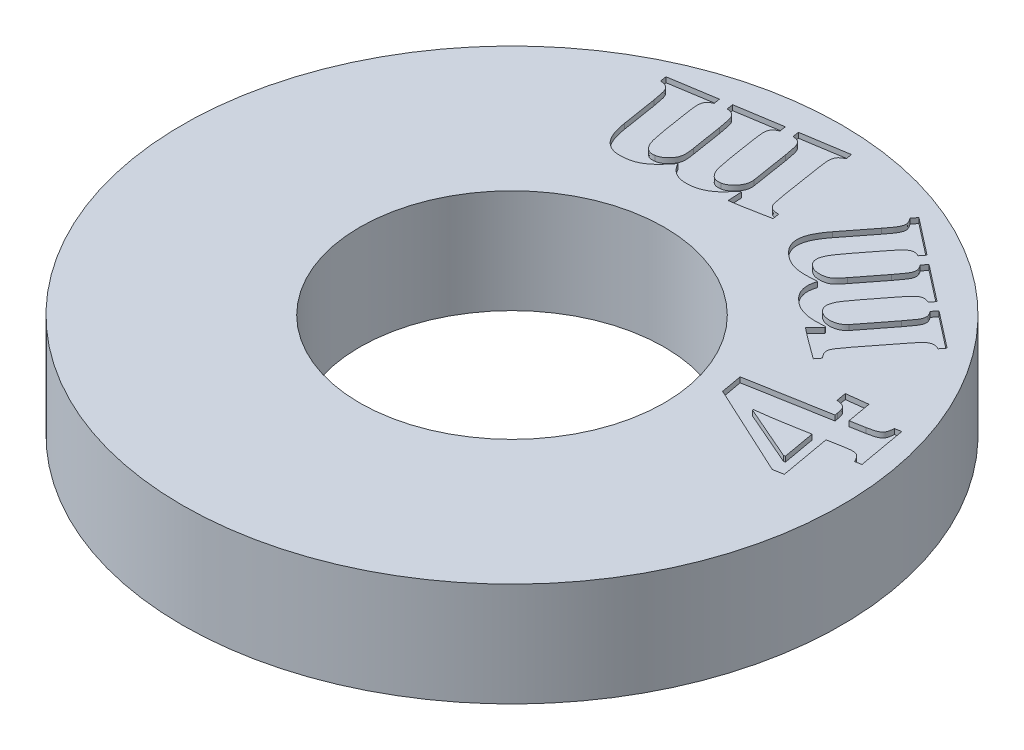
from build123d import *

# Parameters (mm, degrees)
SKETCH1_R           = 12.7
BOSS_EXTRUDE1_DEPTH = 4
SKETCH2_R           = 5.8674
CUT_EXTRUDE1_DEPTH  = 19.40054347
CUT_EXTRUDE2_DEPTH  = 0.2


with BuildPart() as part:
    # Sketch1 → Boss-Extrude1 (new body)
    with BuildSketch(Plane(origin=(0, 0, 0), x_dir=(1, 0, 0), z_dir=(0, 1, 0))):
        with Locations(Location((0, 0, 0), (0, 0, 270))):
            Circle(SKETCH1_R)
    extrude(amount=BOSS_EXTRUDE1_DEPTH)

    # Sketch2 → Cut-Extrude1 (cut, through all)
    with BuildSketch(Plane(origin=(0, 0, 0), x_dir=(-1, 0, 0), z_dir=(0, -1, 0))):
        with Locations(Location((0, 0, 0), (0, 0, 90))):
            Circle(SKETCH2_R)
    extrude(amount=-CUT_EXTRUDE1_DEPTH, mode=Mode.SUBTRACT)

    # Sketch4 → Cut-Extrude2 (cut)
    # profile 1 of 3: a face of its own
    with BuildSketch(Plane(origin=(0, 4, 0), x_dir=(1, 0, 0), z_dir=(0, 1, 0))):
        with BuildLine():
            add(Edge.make_bspline(
                [(11.488408618, 1.713177083), (11.469838832, 1.751163486), (11.436392431, 1.81958153), (11.378099004, 1.90717716), (11.314847291, 1.972864293), (11.237317047, 2.013217491), (11.145336245, 2.031877301), (11.036310839, 2.027073218), (10.905471379, 2.011895355), (10.810712295, 1.995562245), (10.75859959, 1.986579861)],
                knots=[0, 0, 0, 0, 1.150028644, 2.071338816, 2.856635104, 3.60405379, 4.412524947, 5.383041063, 6.560804909, 8, 8, 8, 8], degree=3))
            Line((10.75859959, 1.986579861), (10.213998896, 1.889565972))
            Line((10.213998896, 1.889565972), (10.562366951, -0.068350694))
            Line((10.562366951, -0.068350694), (10.167696812, -0.13890625))
            Line((10.167696812, -0.13890625), (6.603538826, 1.513637153))
            Line((6.603538826, 1.513637153), (6.456915562, 2.334947917))
            Line((6.456915562, 2.334947917), (9.561360007, 2.888368056))
            Line((9.561360007, 2.888368056), (9.541516257, 3.001918403))
            add(Edge.make_bspline(
                [(9.541516257, 3.001918403), (9.53621884, 3.029525548), (9.526503379, 3.080157044), (9.510174137, 3.149094233), (9.493400102, 3.204430233), (9.468458459, 3.259415491), (9.428357686, 3.315475518), (9.371014626, 3.355777123), (9.313871477, 3.381367905), (9.256659474, 3.397341601), (9.187294175, 3.410242281), (9.136608942, 3.415702209), (9.109363479, 3.418637153)],
                knots=[0, 0, 0, 0, 1.247718715, 2.28831579, 3.144719151, 3.808968319, 4.963983276, 6.154957496, 6.870509644, 7.737720758, 8.783928937, 10, 10, 10, 10], degree=3))
            Line((9.109363479, 3.418637153), (9.041012785, 3.802282986))
            Line((9.041012785, 3.802282986), (9.855708965, 3.901501736))
            Line((9.855708965, 3.901501736), (10.021073548, 2.969947917))
            Line((10.021073548, 2.969947917), (10.565674243, 3.066961806))
            add(Edge.make_bspline(
                [(10.565674243, 3.066961806), (10.596191498, 3.072744873), (10.654042391, 3.083707707), (10.735546427, 3.100672221), (10.806327725, 3.119847372), (10.884650937, 3.143106434), (10.964993338, 3.177938075), (11.042473733, 3.230582572), (11.09682001, 3.296665245), (11.127250552, 3.377974375), (11.144207274, 3.473236339), (11.152211458, 3.542056701), (11.156577021, 3.579592014)],
                knots=[0, 0, 0, 0, 1.056895867, 2.003534391, 2.831506833, 3.551299363, 4.782749837, 5.795840817, 6.711673096, 7.642742077, 8.71432796, 10, 10, 10, 10], degree=3))
            Line((11.156577021, 3.579592014), (11.398009312, 3.622586806))
            Line((11.398009312, 3.622586806), (11.72984091, 1.756171875))
            Line((11.72984091, 1.756171875), (11.488408618, 1.713177083))
        make_face()
        with BuildLine():
            Line((9.976976326, 0.558932292), (9.754285354, 1.807986111))
            Line((9.754285354, 1.807986111), (8.917540562, 1.659157986))
            add(Edge.make_bspline(
                [(8.917540562, 1.659157986), (8.828662767, 1.643775664), (8.64857728, 1.612607778), (8.374325176, 1.57121124), (8.092496542, 1.532179982), (7.901875903, 1.509637341), (7.805188132, 1.498203125)],
                knots=[0, 0, 0, 0, 0.962862618, 1.950966311, 2.960676556, 4, 4, 4, 4], degree=3))
            Line((7.805188132, 1.498203125), (7.811802715, 1.461822917))
            Line((7.811802715, 1.461822917), (9.915240215, 0.547907986))
            Line((9.915240215, 0.547907986), (9.976976326, 0.558932292))
        make_face(mode=Mode.SUBTRACT)
    # profile 2 of 3: a face of its own
    with BuildSketch(Plane(origin=(0, 4, 0), x_dir=(1, 0, 0), z_dir=(0, 1, 0))):
        with BuildLine():
            Line((6.446112276, 5.621046804), (6.418551512, 5.656324582))
            add(Edge.make_bspline(
                [(6.418551512, 5.656324582), (6.345103003, 5.650481726), (6.205690041, 5.639391375), (6.006049673, 5.640001619), (5.827169527, 5.650699674), (5.666856777, 5.67597167), (5.521469939, 5.714933464), (5.387561193, 5.768451828), (5.261579098, 5.83414063), (5.185430088, 5.889090651), (5.147449081, 5.916498193)],
                knots=[0, 0, 0, 0, 1.328700104, 2.522011983, 3.598465663, 4.558669638, 5.444794913, 6.307777922, 7.155966722, 8, 8, 8, 8], degree=3))
            add(Edge.make_bspline(
                [(5.147449081, 5.916498193), (5.113549109, 5.943897718), (5.048106477, 5.996791479), (4.961452983, 6.081290035), (4.888569595, 6.165417061), (4.830459206, 6.250285271), (4.784446219, 6.336029232), (4.750511209, 6.423590405), (4.725338541, 6.51279674), (4.712276312, 6.605066622), (4.710185373, 6.700889708), (4.719470407, 6.800614492), (4.739279008, 6.904788894), (4.760550248, 6.974274273), (4.771520262, 7.010109304)],
                knots=[0, 0, 0, 0, 1.254723853, 2.422197594, 3.480533536, 4.455073735, 5.378270259, 6.276377898, 7.154433995, 8.041941717, 8.952311201, 9.908521309, 10.921381655, 12, 12, 12, 12], degree=3))
            add(Edge.make_bspline(
                [(4.771520262, 7.010109304), (4.691090698, 7.003656459), (4.538471998, 6.991411896), (4.321666343, 6.98846259), (4.129911724, 6.995416816), (3.960718577, 7.018564153), (3.808601542, 7.056299759), (3.667745769, 7.110172456), (3.535147857, 7.17881181), (3.454567942, 7.236924978), (3.414428248, 7.265873193)],
                knots=[0, 0, 0, 0, 1.366310217, 2.59263486, 3.670585393, 4.613332156, 5.479848919, 6.319088227, 7.162678639, 8, 8, 8, 8], degree=3))
            add(Edge.make_bspline(
                [(3.414428248, 7.265873193), (3.3775521, 7.295803428), (3.306764809, 7.353257376), (3.21306857, 7.444735382), (3.134735925, 7.535260481), (3.072420666, 7.626680072), (3.027114725, 7.721083516), (2.993029681, 7.816985205), (2.9748084, 7.916670154), (2.967827049, 8.01881721), (2.974809687, 8.124007378), (2.995095498, 8.231959079), (3.028806982, 8.342103336), (3.074329878, 8.45600405), (3.135236882, 8.572567121), (3.206795227, 8.695687314), (3.293019282, 8.822881794), (3.357079528, 8.907680315), (3.390174776, 8.951489512)],
                knots=[0, 0, 0, 0, 1.169264857, 2.244515684, 3.220319539, 4.113963992, 4.959955291, 5.792870505, 6.612950669, 7.447388896, 8.308923635, 9.201834464, 10.146760853, 11.141726431, 12.218423767, 13.382633535, 14.647798067, 16, 16, 16, 16], degree=3))
            Line((3.390174776, 8.951489512), (4.221407414, 10.019744721))
            add(Edge.make_bspline(
                [(4.221407414, 10.019744721), (4.253451667, 10.061583607), (4.315528507, 10.14263483), (4.402700621, 10.258852189), (4.474099835, 10.363054012), (4.52285553, 10.455601314), (4.552580969, 10.535251364), (4.563466398, 10.608503251), (4.558254548, 10.679867299), (4.53147758, 10.75154504), (4.489681708, 10.826689156), (4.454202161, 10.876320457), (4.435278942, 10.902791596)],
                knots=[0, 0, 0, 0, 1.558183804, 3.018548385, 4.296309646, 5.28770402, 6.105589718, 6.797073249, 7.462098622, 8.197436721, 9.038592567, 10, 10, 10, 10], degree=3))
            Line((4.435278942, 10.902791596), (4.585209498, 11.095716943))
            Line((4.585209498, 11.095716943), (5.996320609, 9.99769611))
            Line((5.996320609, 9.99769611), (5.846390053, 9.804770762))
            add(Edge.make_bspline(
                [(5.846390053, 9.804770762), (5.821598554, 9.814853431), (5.775331585, 9.833670142), (5.707363836, 9.85237221), (5.646143658, 9.858436215), (5.590929353, 9.853196728), (5.540343575, 9.836119226), (5.490007513, 9.81172786), (5.439948532, 9.776609976), (5.384915117, 9.732987716), (5.324969903, 9.670799848), (5.252764521, 9.589061458), (5.16514284, 9.485038198), (5.10380747, 9.40664927), (5.070278942, 9.36379854)],
                knots=[0, 0, 0, 0, 0.974495288, 1.818645247, 2.55789592, 3.203887047, 3.821953837, 4.492443581, 5.234959137, 6.043992897, 7.047297203, 8.374577793, 10.01818969, 12, 12, 12, 12], degree=3))
            Line((5.070278942, 9.36379854), (4.459532414, 8.578867985))
            add(Edge.make_bspline(
                [(4.459532414, 8.578867985), (4.427040039, 8.536727017), (4.36533113, 8.456693682), (4.279860313, 8.340926267), (4.207480509, 8.23488918), (4.144743666, 8.140152652), (4.093939387, 8.053261371), (4.055224804, 7.972382939), (4.025674683, 7.897486598), (4.007618905, 7.827463577), (3.999758774, 7.762907557), (3.999966382, 7.703395202), (4.005428339, 7.648104338), (4.021722039, 7.597238119), (4.045740851, 7.549179791), (4.078974228, 7.503189368), (4.121883321, 7.458704343), (4.154616135, 7.431294161), (4.171798039, 7.416906179)],
                knots=[0, 0, 0, 0, 1.888953508, 3.587465034, 5.107152686, 6.445866775, 7.620537267, 8.676590056, 9.626254862, 10.474157069, 11.23623705, 11.927603465, 12.58451522, 13.199276758, 13.811819934, 14.485105834, 15.204811187, 16, 16, 16, 16], degree=3))
            add(Edge.make_bspline(
                [(4.171798039, 7.416906179), (4.196907921, 7.398623115), (4.24575502, 7.363056452), (4.329546375, 7.32690278), (4.419900083, 7.306286873), (4.515987475, 7.298075567), (4.611843152, 7.301326536), (4.703352488, 7.308761322), (4.788476175, 7.328417137), (4.868537558, 7.362467429), (4.944132959, 7.410449543), (5.003782637, 7.463505766), (5.054181963, 7.517595359), (5.101176163, 7.571027473), (5.155289779, 7.638105142), (5.193805445, 7.686959904), (5.214697345, 7.713459999)],
                knots=[0, 0, 0, 0, 1.060451807, 2.062932707, 3.097103212, 4.220994073, 5.353228603, 6.376944908, 7.359261765, 8.328691766, 9.340596163, 10.410182602, 11.05076008, 11.870698325, 12.845011315, 14, 14, 14, 14], degree=3))
            Line((5.214697345, 7.713459999), (5.957735539, 8.66816486))
            add(Edge.make_bspline(
                [(5.957735539, 8.66816486), (5.982092993, 8.699319813), (6.027952625, 8.757977615), (6.090423825, 8.841053313), (6.142342187, 8.913544593), (6.197870379, 8.990195), (6.249297759, 9.073408186), (6.29114706, 9.165636672), (6.310604917, 9.252795431), (6.30324831, 9.324426645), (6.285186466, 9.381667531), (6.264023921, 9.429739499), (6.232698883, 9.48084353), (6.207857504, 9.515367573), (6.194758109, 9.533572846)],
                knots=[0, 0, 0, 0, 1.428852229, 2.69020885, 3.755221618, 4.650440021, 6.110052653, 7.281631402, 8.297160143, 9.297295893, 9.839073942, 10.463254767, 11.189641066, 12, 12, 12, 12], degree=3))
            Line((6.194758109, 9.533572846), (6.344688664, 9.726498193))
            Line((6.344688664, 9.726498193), (7.739263317, 8.640604096))
            Line((7.739263317, 8.640604096), (7.589332762, 8.447678749))
            add(Edge.make_bspline(
                [(7.589332762, 8.447678749), (7.564184317, 8.458169169), (7.516888214, 8.477898261), (7.447738497, 8.497032573), (7.385486432, 8.504959726), (7.329450384, 8.499379022), (7.278376194, 8.482329334), (7.227319552, 8.459564119), (7.178554253, 8.423744301), (7.124521011, 8.380289164), (7.065790511, 8.31767881), (6.99307334, 8.236382683), (6.90602346, 8.130825514), (6.84391499, 8.052041093), (6.809914359, 8.008911387)],
                knots=[0, 0, 0, 0, 0.986342731, 1.854992093, 2.591493093, 3.247165752, 3.874524497, 4.535580437, 5.263002682, 6.057269968, 7.045676649, 8.365642244, 10.010408946, 12, 12, 12, 12], degree=3))
            Line((6.809914359, 8.008911387), (6.199167831, 7.223980832))
            add(Edge.make_bspline(
                [(6.199167831, 7.223980832), (6.1751448, 7.193217202), (6.128820384, 7.133894666), (6.064470667, 7.047003547), (6.005667413, 6.967536238), (5.953399564, 6.894695326), (5.908577343, 6.827540339), (5.869029665, 6.766708727), (5.837481339, 6.710333021), (5.802625077, 6.644943933), (5.770963015, 6.567952334), (5.744339164, 6.480543218), (5.734321689, 6.398573054), (5.736407268, 6.323235217), (5.755317287, 6.253747629), (5.786992728, 6.186877603), (5.838949571, 6.122592111), (5.883831274, 6.085438123), (5.908126164, 6.065326318)],
                knots=[0, 0, 0, 0, 1.387103131, 2.674797394, 3.842386028, 4.900548409, 5.86041802, 6.711809731, 7.478006622, 8.155605191, 9.344042684, 10.43114453, 11.391724629, 12.267604767, 13.091197959, 13.932310922, 14.880740337, 16, 16, 16, 16], degree=3))
            add(Edge.make_bspline(
                [(5.908126164, 6.065326318), (5.92724958, 6.05188526), (5.966036324, 6.024623661), (6.032692056, 5.993550347), (6.107049239, 5.971043667), (6.187819264, 5.954527731), (6.272883487, 5.946510823), (6.359519721, 5.950174322), (6.446294721, 5.963823989), (6.53258789, 5.986026651), (6.614596751, 6.020389001), (6.690833791, 6.063035119), (6.757619821, 6.117520035), (6.794712531, 6.160658186), (6.813221651, 6.182183957)],
                knots=[0, 0, 0, 0, 0.841485411, 1.706728545, 2.636983739, 3.637338779, 4.674903333, 5.709078804, 6.7546484, 7.837656936, 8.912857559, 9.95143668, 10.977774795, 12, 12, 12, 12], degree=3))
            Line((6.813221651, 6.182183957), (7.695166095, 7.315482568))
            add(Edge.make_bspline(
                [(7.695166095, 7.315482568), (7.728014018, 7.358000395), (7.788496594, 7.436288075), (7.869304066, 7.544976045), (7.931241751, 7.634991871), (7.976730187, 7.708273557), (8.008966806, 7.771056115), (8.029709996, 7.829288183), (8.042924298, 7.885143031), (8.045069208, 7.940051692), (8.037490603, 7.996136863), (8.014924563, 8.054405487), (7.980117392, 8.116225886), (7.950303267, 8.156952636), (7.934393526, 8.178685693)],
                knots=[0, 0, 0, 0, 1.946253878, 3.583619155, 4.90541557, 5.903065839, 6.706730513, 7.456203084, 8.137693296, 8.777198399, 9.436082692, 10.17303834, 11.025076595, 12, 12, 12, 12], degree=3))
            Line((7.934393526, 8.178685693), (8.084324081, 8.37161104))
            Line((8.084324081, 8.37161104), (9.487718178, 7.27910236))
            Line((9.487718178, 7.27910236), (9.337787623, 7.086177012))
            add(Edge.make_bspline(
                [(9.337787623, 7.086177012), (9.310775429, 7.0966318), (9.260723911, 7.116003717), (9.187673864, 7.135537847), (9.123019149, 7.144452452), (9.064830325, 7.140087962), (9.012522306, 7.124265196), (8.960801373, 7.102391813), (8.910212078, 7.069482703), (8.856472687, 7.026121446), (8.796761068, 6.965984534), (8.724427609, 6.885322286), (8.638553239, 6.78089514), (8.576615815, 6.702998059), (8.542935192, 6.660638818)],
                knots=[0, 0, 0, 0, 1.0399122, 1.926877353, 2.71123319, 3.373420874, 4.004478301, 4.666665984, 5.384545304, 6.163885671, 7.144097132, 8.424650005, 10.055779381, 12, 12, 12, 12], degree=3))
            Line((8.542935192, 6.660638818), (7.60586922, 5.456784651))
            add(Edge.make_bspline(
                [(7.60586922, 5.456784651), (7.579695927, 5.423041412), (7.531000421, 5.360261992), (7.464615767, 5.272214489), (7.410772827, 5.196862452), (7.35505243, 5.118965683), (7.3062141, 5.034369264), (7.266301268, 4.941020505), (7.257033, 4.850826575), (7.268994039, 4.777697278), (7.294307526, 4.717385158), (7.326608903, 4.665864149), (7.367927347, 4.606464412), (7.401556879, 4.566478611), (7.419558456, 4.545074582)],
                knots=[0, 0, 0, 0, 1.450639645, 2.698920323, 3.745170182, 4.597024574, 5.950243738, 7.060652374, 8.014587129, 8.989365666, 9.543411076, 10.226324432, 11.050567859, 12, 12, 12, 12], degree=3))
            Line((7.419558456, 4.545074582), (7.264115748, 4.345534651))
            Line((7.264115748, 4.345534651), (6.442804984, 4.947461735))
            Line((6.442804984, 4.947461735), (6.074593178, 5.234093679))
            Line((6.074593178, 5.234093679), (6.446112276, 5.621046804))
        make_face()
    # profile 3 of 3: a face of its own
    with BuildSketch(Plane(origin=(0, 4, 0), x_dir=(1, 0, 0), z_dir=(0, 1, 0))):
        with BuildLine():
            Line((0.313853362, 8.525956305), (0.266448848, 8.530366027))
            add(Edge.make_bspline(
                [(0.266448848, 8.530366027), (0.220587801, 8.472712263), (0.133110419, 8.362740934), (-0.004365315, 8.216579062), (-0.134419634, 8.091399905), (-0.26345541, 7.991600635), (-0.391287899, 7.911021784), (-0.522521219, 7.849326117), (-0.657183893, 7.801559088), (-0.750062007, 7.783960964), (-0.796294208, 7.775201097)],
                knots=[0, 0, 0, 0, 1.321709555, 2.521087024, 3.598960819, 4.558109064, 5.44394598, 6.305457593, 7.156502851, 8, 8, 8, 8], degree=3))
            add(Edge.make_bspline(
                [(-0.796294208, 7.775201097), (-0.839944877, 7.768960851), (-0.923669459, 7.756991687), (-1.045452622, 7.751329453), (-1.157309896, 7.756606178), (-1.259753383, 7.771731323), (-1.354164127, 7.797300062), (-1.441453203, 7.833576517), (-1.52489044, 7.87569231), (-1.601582422, 7.92961482), (-1.673310621, 7.993632909), (-1.739982334, 8.068486542), (-1.802626549, 8.154631273), (-1.839037783, 8.217645133), (-1.857934833, 8.250348666)],
                knots=[0, 0, 0, 0, 1.262383675, 2.421327046, 3.485651979, 4.465097507, 5.381738202, 6.278834679, 7.168553644, 8.05321575, 8.955237983, 9.91670527, 10.918791849, 12, 12, 12, 12], degree=3))
            add(Edge.make_bspline(
                [(-1.857934833, 8.250348666), (-1.90877596, 8.187008607), (-2.00522163, 8.066852448), (-2.151117808, 7.90429903), (-2.290041501, 7.770169918), (-2.42237, 7.660920578), (-2.554191293, 7.574649228), (-2.690177048, 7.508178238), (-2.831656224, 7.457141582), (-2.929902909, 7.438416019), (-2.979106708, 7.429037902)],
                knots=[0, 0, 0, 0, 1.367019779, 2.593237953, 3.673809289, 4.614754209, 5.477752088, 6.31872209, 7.157984213, 8, 8, 8, 8], degree=3))
            add(Edge.make_bspline(
                [(-2.979106708, 7.429037902), (-3.026059084, 7.422313077), (-3.116363637, 7.40937907), (-3.247369376, 7.404275703), (-3.367795645, 7.408861262), (-3.477868354, 7.42618411), (-3.579049507, 7.456379764), (-3.672210418, 7.498761458), (-3.759200344, 7.552032666), (-3.839177412, 7.617470965), (-3.910830954, 7.695734725), (-3.976479508, 7.784665243), (-4.034537182, 7.885532337), (-4.086457137, 7.997681719), (-4.132118696, 8.122243067), (-4.168735586, 8.260041405), (-4.205840999, 8.409494464), (-4.222701413, 8.514404278), (-4.231467819, 8.568951097)],
                knots=[0, 0, 0, 0, 1.161439086, 2.233821674, 3.207260032, 4.110189863, 4.956199937, 5.786297692, 6.610908432, 7.449024294, 8.309099073, 9.204093284, 10.152261841, 11.155272774, 12.229128442, 13.397873342, 14.647050006, 16, 16, 16, 16], degree=3))
            Line((-4.231467819, 8.568951097), (-4.445339347, 9.915018805))
            add(Edge.make_bspline(
                [(-4.445339347, 9.915018805), (-4.453968854, 9.967233872), (-4.470648589, 10.068158929), (-4.49743887, 10.211380795), (-4.524685526, 10.335077023), (-4.557401262, 10.434852747), (-4.596893377, 10.510944501), (-4.643015377, 10.569856606), (-4.700587884, 10.614839055), (-4.771670566, 10.64401948), (-4.854978101, 10.666808477), (-4.91554102, 10.67330914), (-4.94804768, 10.676798319)],
                knots=[0, 0, 0, 0, 1.556776784, 3.009050718, 4.285993182, 5.280798359, 6.088364277, 6.795732101, 7.466033526, 8.211290206, 9.039924425, 10, 10, 10, 10], degree=3))
            Line((-4.94804768, 10.676798319), (-4.986632749, 10.920435472))
            Line((-4.986632749, 10.920435472), (-3.209514694, 11.202657694))
            Line((-3.209514694, 11.202657694), (-3.170929624, 10.959020541))
            add(Edge.make_bspline(
                [(-3.170929624, 10.959020541), (-3.1955222, 10.948274173), (-3.241636376, 10.928123379), (-3.301383001, 10.890257762), (-3.349616556, 10.851198802), (-3.382533123, 10.806155645), (-3.405703355, 10.757404121), (-3.419878086, 10.703054317), (-3.431779295, 10.642767853), (-3.435574724, 10.57245081), (-3.432618312, 10.485524547), (-3.422064489, 10.375927445), (-3.403820359, 10.240039117), (-3.388657088, 10.140990442), (-3.38039143, 10.086997972)],
                knots=[0, 0, 0, 0, 0.969779354, 1.818458417, 2.554157673, 3.20052523, 3.8192083, 4.496967745, 5.227358508, 6.040378365, 7.038205311, 8.373543936, 10.023180803, 12, 12, 12, 12], degree=3))
            Line((-3.38039143, 10.086997972), (-3.223846291, 9.099220194))
            add(Edge.make_bspline(
                [(-3.223846291, 9.099220194), (-3.215227763, 9.046636467), (-3.198810146, 8.946468614), (-3.172292417, 8.804233798), (-3.146374998, 8.677591368), (-3.119216219, 8.56625168), (-3.088752441, 8.469337514), (-3.058340166, 8.383915324), (-3.020988556, 8.311907887), (-2.983052645, 8.250047646), (-2.9403307, 8.200299225), (-2.896928005, 8.158691062), (-2.852193168, 8.125100637), (-2.803967184, 8.101198407), (-2.752634363, 8.085140565), (-2.695940612, 8.079901249), (-2.634163691, 8.077597969), (-2.591377829, 8.083895558), (-2.569002541, 8.087188944)],
                knots=[0, 0, 0, 0, 1.879302477, 3.579923031, 5.102516498, 6.43847557, 7.619109878, 8.685516954, 9.630316028, 10.475250734, 11.238613256, 11.935364263, 12.593814088, 13.202415535, 13.825608582, 14.478293096, 15.204208384, 16, 16, 16, 16], degree=3))
            add(Edge.make_bspline(
                [(-2.569002541, 8.087188944), (-2.538163079, 8.093382104), (-2.478532253, 8.105357128), (-2.394656651, 8.14283353), (-2.317494931, 8.195021488), (-2.24573651, 8.260419012), (-2.181107746, 8.332153066), (-2.123831091, 8.404596344), (-2.079289987, 8.480367808), (-2.050670586, 8.56285552), (-2.034279614, 8.650879435), (-2.03038681, 8.730698931), (-2.035644191, 8.804578121), (-2.042089163, 8.876314479), (-2.053342192, 8.963059354), (-2.063191476, 9.025749928), (-2.068499069, 9.059532694)],
                knots=[0, 0, 0, 0, 1.066239177, 2.061667717, 3.097334799, 4.220563205, 5.352161382, 6.376319012, 7.355316561, 8.323097728, 9.327340028, 10.390062672, 11.0280924, 11.843315407, 12.837803384, 14, 14, 14, 14], degree=3))
            Line((-2.068499069, 9.059532694), (-2.259219555, 10.261182))
            add(Edge.make_bspline(
                [(-2.259219555, 10.261182), (-2.265189068, 10.300550507), (-2.276367674, 10.374272601), (-2.296122881, 10.476856372), (-2.311449485, 10.565092055), (-2.333244723, 10.658190139), (-2.357413956, 10.753633086), (-2.397599585, 10.847457095), (-2.4488931, 10.920993429), (-2.506101212, 10.965507213), (-2.560536594, 10.991486992), (-2.609969791, 11.008449388), (-2.668336298, 11.019413766), (-2.710093776, 11.025341112), (-2.732162263, 11.028473666)],
                knots=[0, 0, 0, 0, 1.433434736, 2.68427268, 3.761168802, 4.656659373, 6.126928261, 7.29968854, 8.313279962, 9.321676997, 9.866066009, 10.48111294, 11.19728056, 12, 12, 12, 12], degree=3))
            Line((-2.732162263, 11.028473666), (-2.770747333, 11.272110819))
            Line((-2.770747333, 11.272110819), (-1.016780319, 11.549923319))
            Line((-1.016780319, 11.549923319), (-0.978195249, 11.306286166))
            add(Edge.make_bspline(
                [(-0.978195249, 11.306286166), (-1.003539507, 11.295588296), (-1.05081222, 11.275634372), (-1.111895494, 11.237496403), (-1.161160656, 11.198478729), (-1.195529293, 11.153275612), (-1.219332957, 11.104376677), (-1.233858811, 11.049994325), (-1.245845766, 10.990428501), (-1.248131032, 10.920389717), (-1.244252884, 10.834232839), (-1.232099021, 10.724754883), (-1.214563153, 10.58839066), (-1.199286672, 10.488617856), (-1.190964347, 10.434263597)],
                knots=[0, 0, 0, 0, 0.989028705, 1.844759954, 2.586937196, 3.238107674, 3.871415783, 4.533125195, 5.259921945, 6.054965184, 7.048323037, 8.365174644, 10.01981869, 12, 12, 12, 12], degree=3))
            Line((-1.190964347, 10.434263597), (-1.034419208, 9.446485819))
            add(Edge.make_bspline(
                [(-1.034419208, 9.446485819), (-1.028284705, 9.407515179), (-1.016522902, 9.332796012), (-0.997794986, 9.225472348), (-0.978788568, 9.127843148), (-0.957118142, 9.015092544), (-0.92713746, 8.896731465), (-0.890202667, 8.776099361), (-0.846829242, 8.680304169), (-0.799827341, 8.60076994), (-0.746857119, 8.537114013), (-0.691097612, 8.485253813), (-0.626591832, 8.452528987), (-0.556339665, 8.428456815), (-0.472992748, 8.422934964), (-0.414757912, 8.430379669), (-0.382882749, 8.434454569)],
                knots=[0, 0, 0, 0, 1.217997893, 2.335291105, 3.363301837, 4.288921831, 5.879406356, 7.131588601, 8.17759787, 9.119347984, 9.973511448, 10.729163452, 11.449941662, 12.189059626, 13.008771681, 14, 14, 14, 14], degree=3))
            add(Edge.make_bspline(
                [(-0.382882749, 8.434454569), (-0.359875434, 8.438812656), (-0.312670065, 8.447754381), (-0.244525142, 8.476737934), (-0.176304789, 8.514964956), (-0.108641116, 8.562544432), (-0.045650694, 8.620933806), (0.012522922, 8.686043096), (0.061956884, 8.7593599), (0.103685428, 8.838283335), (0.136408142, 8.921606199), (0.154309625, 9.007588437), (0.162701488, 9.094558661), (0.155463208, 9.151799875), (0.15179607, 9.180800055)],
                knots=[0, 0, 0, 0, 0.835871289, 1.715002913, 2.633388593, 3.633187471, 4.666417129, 5.700650574, 6.751143417, 7.821774814, 8.891517419, 9.941351542, 10.95702464, 12, 12, 12, 12], degree=3))
            Line((0.15179607, 9.180800055), (-0.074202194, 10.607345194))
            add(Edge.make_bspline(
                [(-0.074202194, 10.607345194), (-0.0827033, 10.660686047), (-0.098328527, 10.758727753), (-0.124174258, 10.892356055), (-0.146107794, 11.000081328), (-0.168777011, 11.084461368), (-0.192328462, 11.151581226), (-0.219827574, 11.207320309), (-0.252192214, 11.254760428), (-0.290360467, 11.294727515), (-0.337845169, 11.326906546), (-0.395953257, 11.350746254), (-0.4656423, 11.366694908), (-0.515833552, 11.372583246), (-0.54273518, 11.375739291)],
                knots=[0, 0, 0, 0, 1.944391131, 3.573835333, 4.89976862, 5.901119108, 6.717182758, 7.456739864, 8.131968056, 8.777512876, 9.434346179, 10.181320822, 11.025219969, 12, 12, 12, 12], degree=3))
            Line((-0.54273518, 11.375739291), (-0.581320249, 11.619376444))
            Line((-0.581320249, 11.619376444), (1.18367107, 11.898291375))
            Line((1.18367107, 11.898291375), (1.22225614, 11.654654222))
            add(Edge.make_bspline(
                [(1.22225614, 11.654654222), (1.19625358, 11.642320887), (1.14785195, 11.619363395), (1.083956718, 11.579411666), (1.033199809, 11.537997656), (0.996115313, 11.492400193), (0.971907979, 11.442441633), (0.952327319, 11.389471255), (0.942318303, 11.329790665), (0.936003298, 11.261211079), (0.939860158, 11.175976409), (0.950170447, 11.067904886), (0.968541079, 10.933108835), (0.983606087, 10.834419647), (0.991848153, 10.780426791)],
                knots=[0, 0, 0, 0, 1.029437697, 1.916213766, 2.690941621, 3.364738409, 4.000075764, 4.6698806, 5.379325844, 6.158174325, 7.131901521, 8.426385959, 10.044875728, 12, 12, 12, 12], degree=3))
            Line((0.991848153, 10.780426791), (1.231075584, 9.265687208))
            add(Edge.make_bspline(
                [(1.231075584, 9.265687208), (1.237812541, 9.223017488), (1.250316557, 9.14382107), (1.271234809, 9.034259492), (1.286790608, 8.942078167), (1.306037446, 8.847585285), (1.33297969, 8.753531648), (1.375000791, 8.660340036), (1.434691793, 8.591618497), (1.496545931, 8.549250257), (1.558872086, 8.528494985), (1.618128233, 8.514144363), (1.690939166, 8.504851265), (1.743684451, 8.501383727), (1.772368987, 8.499497972)],
                knots=[0, 0, 0, 0, 1.45510247, 2.700718576, 3.757006257, 4.604314627, 5.947710583, 7.049444465, 8.014850273, 8.979620945, 9.531703584, 10.219269411, 11.031582988, 12, 12, 12, 12], degree=3))
            Line((1.772368987, 8.499497972), (1.812056487, 8.249246236))
            Line((1.812056487, 8.249246236), (0.80663982, 8.05962818))
            Line((0.80663982, 8.05962818), (0.341414126, 7.985765333))
            Line((0.341414126, 7.985765333), (0.313853362, 8.525956305))
        make_face()
    extrude(amount=-CUT_EXTRUDE2_DEPTH, mode=Mode.SUBTRACT)


solid = part.part
